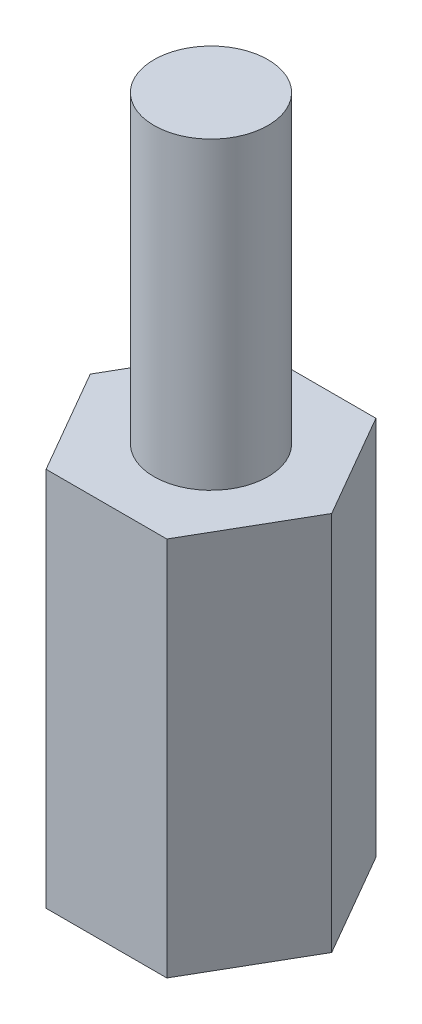
from build123d import *

# Parameters (mm, degrees)
BOSS_EXTRUDE1_DEPTH = 10
SKETCH2_R           = 1.5
BOSS_EXTRUDE2_DEPTH = 8


with BuildPart() as part:
    # Sketch1 → Boss-Extrude1 (new body)
    with BuildSketch(Plane(origin=(0, 0, 0), x_dir=(1, 0, 0), z_dir=(0, 1, 0))):
        Polygon((3.175426481, 0), (1.58771324, 2.75), (-1.58771324, 2.75), (-3.175426481, 0), (-1.58771324, -2.75), (1.58771324, -2.75), align=None)
    extrude(amount=-BOSS_EXTRUDE1_DEPTH)

    # Sketch2 → Boss-Extrude2 (add)
    with BuildSketch(Plane(origin=(0, 0, 0), x_dir=(1, 0, 0), z_dir=(0, 1, 0))):
        with Locations(Location((0, 0, 0), (0, 0, 270))):
            Circle(SKETCH2_R)
    extrude(amount=BOSS_EXTRUDE2_DEPTH)


solid = part.part
